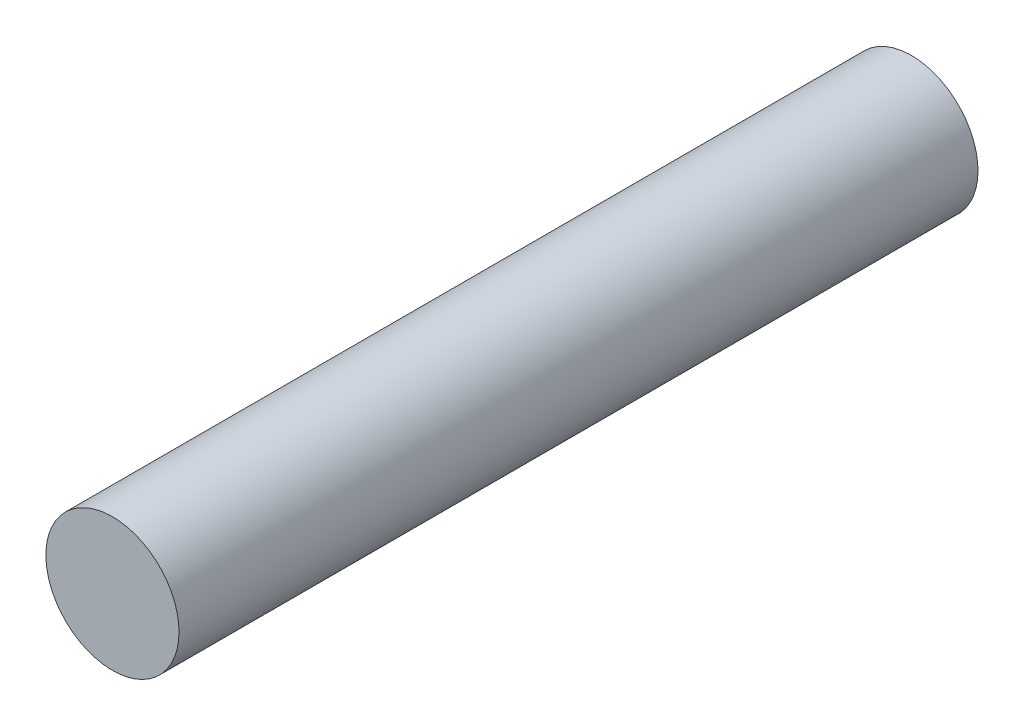
from build123d import *

# Parameters (mm, degrees)
BOSS_EXTRUDE1_DEPTH      = 6
BOSS_EXTRUDE1_DEPTH_BACK = 6
SKETCH1_R                = 1


with BuildPart() as part:
    # Sketch1 → Boss-Extrude1 (new, two sides: drawn at the far end of the back side and taken through both)
    with BuildSketch(Plane.XY.offset(-BOSS_EXTRUDE1_DEPTH_BACK)):
        Circle(SKETCH1_R)
    extrude(amount=BOSS_EXTRUDE1_DEPTH + BOSS_EXTRUDE1_DEPTH_BACK)


solid = part.part
